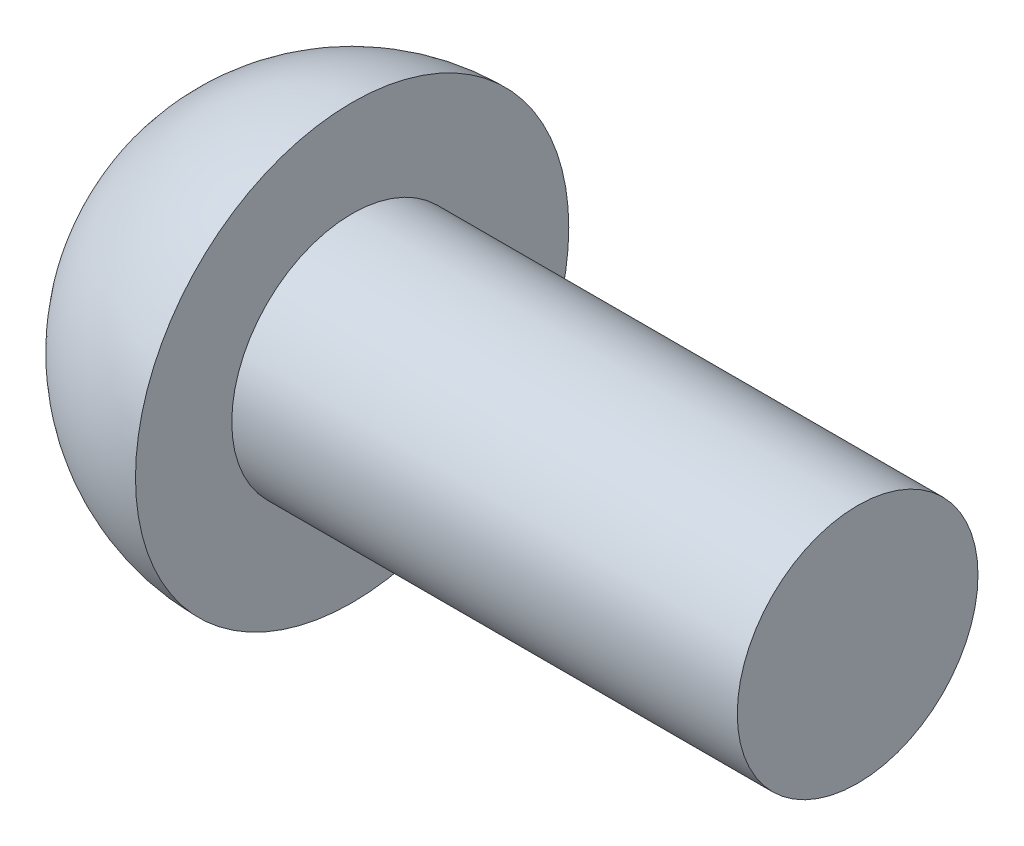
from build123d import *


with BuildPart() as part:
    # Sketch1 → Revolve1 (revolve)
    with BuildSketch(Plane.XY, mode=Mode.PRIVATE) as revolve1_sk:
        with BuildLine():
            Line((0, 0), (0, 5))
            Line((0, 5), (-21, 5))
            Line((-21, 5), (-21, 9))
            ThreePointArc((-21, 9), (-27.363961031, 6.363961031), (-30, 0))
            Line((-30, 0), (0, 0))
        make_face()
    revolve(revolve1_sk.sketch.rotate(Axis((-30, 0, 0), (1, 0, 0)), 180), axis=Axis((-30, 0, 0), (1, 0, 0)))


solid = part.part
